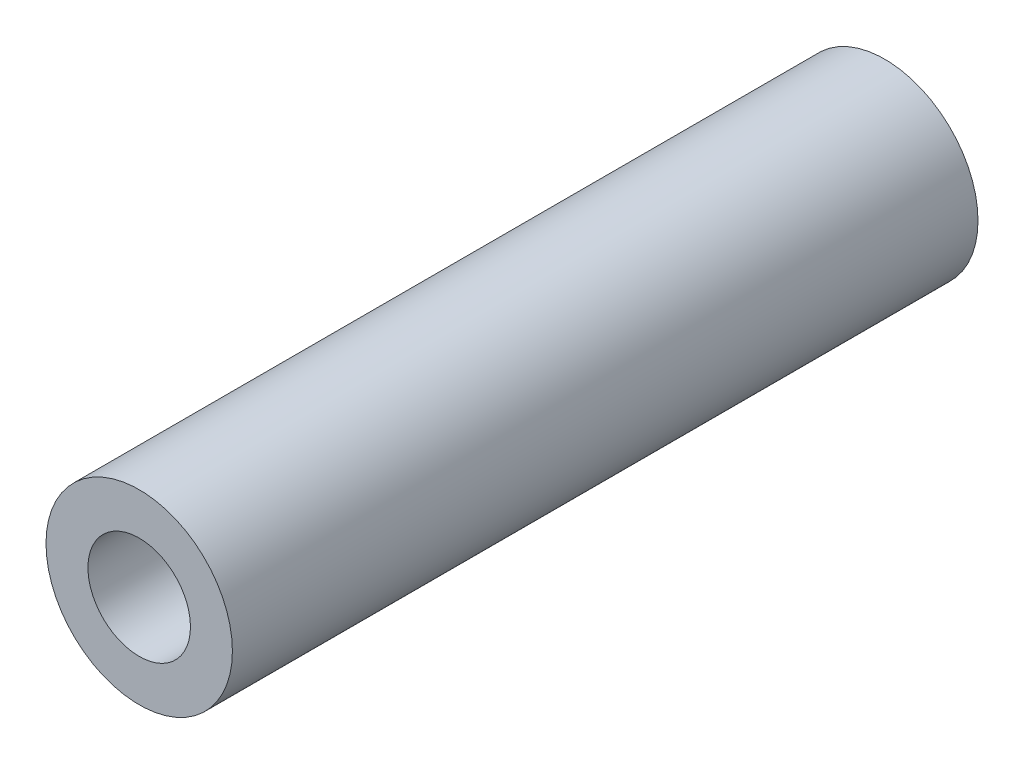
from build123d import *

# Parameters (mm, degrees)
SZKIC1_W = 120
SZKIC1_H = 15
SZKIC2_W = 120
SZKIC2_H = 8.25


with BuildPart() as part:
    # Szkic1 → Obrót1 (revolve)
    with BuildSketch(Plane(origin=(0, 0, 0), x_dir=(0, 0, -1), z_dir=(1, 0, 0))):
        with Locations((-60, 7.5)):
            Rectangle(SZKIC1_W, SZKIC1_H)
    revolve(axis=Axis((0, 0, 0), (0, 0, 1)))

    # Szkic2 → Wycięcie-obrót1 (revolve, cut)
    with BuildSketch(Plane(origin=(0, 0, 0), x_dir=(0, 0, -1), z_dir=(1, 0, 0))):
        with Locations((-60, 4.125)):
            Rectangle(SZKIC2_W, SZKIC2_H)
    revolve(axis=Axis((0, 0, 0), (0, 0, 1)), mode=Mode.SUBTRACT)


solid = part.part
